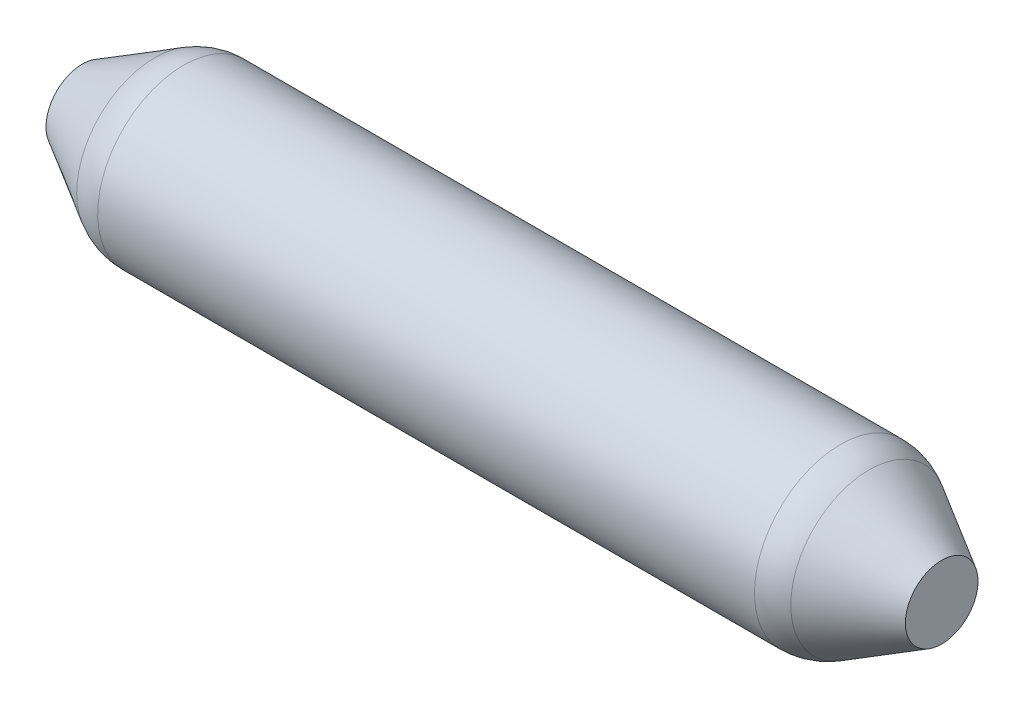
from build123d import *

# Parameters (mm, degrees)
VERRUNDUNG1_R = 2


with BuildPart() as part:
    # Skizze1 → Rotation1 (revolve)
    with BuildSketch(Plane.XY, mode=Mode.PRIVATE) as rotation1_sk:
        Polygon((0, 0), (0, 1.267949192), (3, 3), (27, 3), (30, 1.267949192), (30, 0), align=None)
    revolve(rotation1_sk.sketch.rotate(Axis((0, 0, 0), (1, 0, 0)), 180), axis=Axis((0, 0, 0), (1, 0, 0)))

    # Verrundung1
    verrundung1_edges = [part.edges().sort_by_distance(p)[0] for p in [
        (3, 3, 0),
        (27, 3, 0),
    ]]
    fillet(verrundung1_edges, radius=VERRUNDUNG1_R)


solid = part.part
